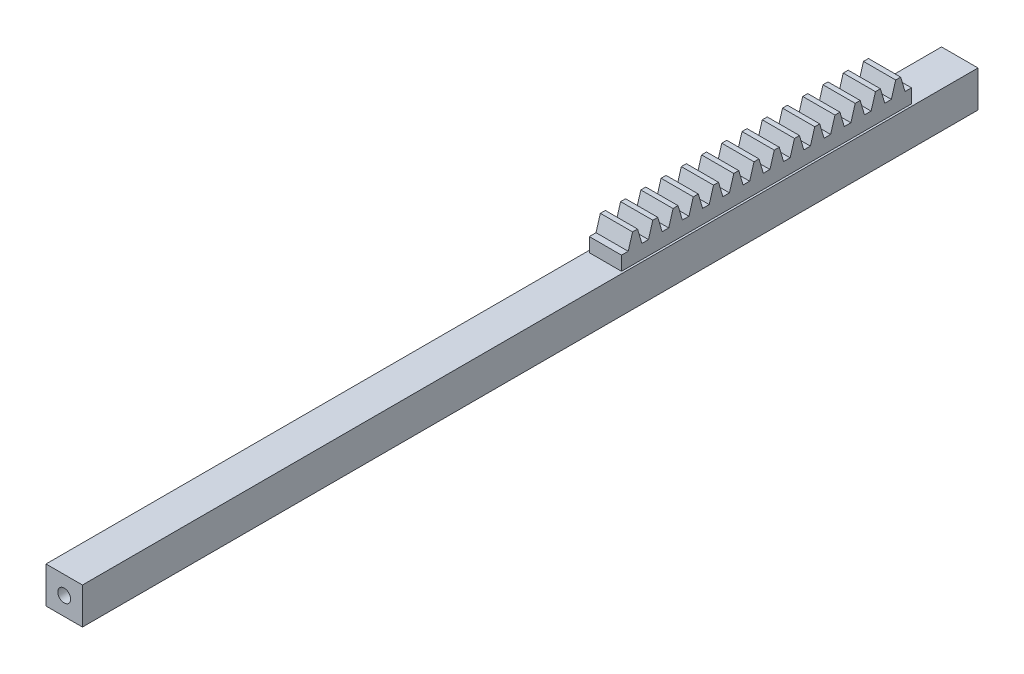
from build123d import *

# Parameters (mm, degrees)
ESQUISSE1_W                    = 5
ESQUISSE1_H                    = 45
BOSS_EXTRU_1_DEPTH             = 5
CARR_DEPTH                     = 10
CARR_DEPTH_BACK                = 129
ESQUISSE7_W                    = 5.65685425
ESQUISSE7_H                    = 5.65685425
BOSS_EXTRU_3_REACH             = 108.655
BOSS_EXTRU_3_DIRECTION_2_REACH = 108.655
R_P_TITION_LIN_AIRE1_COUNT     = 14
R_P_TITION_LIN_AIRE1_PITCH     = 3.141592
ESQUISSE8_R                    = 1
ENL_V_MAT_EXTRU_3_DEPTH        = 10
ENL_V_START                    = -10
ESQUISSE9_R                    = 1
ENL_V_MAT_EXTRU_4_DEPTH        = 10


with BuildPart() as part:
    # Esquisse1 → Boss.-Extru.1 (new body)
    with BuildSketch(Plane(origin=(0, 0, 0), x_dir=(1, 0, 0), z_dir=(0, 1, 0))):
        Rectangle(ESQUISSE1_W, ESQUISSE1_H)
    extrude(amount=BOSS_EXTRU_1_DEPTH)

    # Esquisse7 → Carré (add, two sides: drawn at the far end of the back side and taken through both)
    with BuildSketch(Plane(origin=(0, 0, -22.5), x_dir=(-1, 0, 0), z_dir=(0, 0, -1)).offset(-CARR_DEPTH_BACK)):
        Rectangle(ESQUISSE7_W, ESQUISSE7_H)
    extrude(amount=CARR_DEPTH + CARR_DEPTH_BACK)

    # Boss.-Extru.3: up to this face of the body (flat: up to its plane)
    boss_extru_3_end = Plane(part.part.faces().sort_by_distance((2.5, 3.914213562, 0))[0])
    # Esquisse3 → Boss.-Extru.3 (add, up to the picked face)
    with BuildSketch(Plane(origin=(0, 0, 0), x_dir=(0, 0, -1), z_dir=(1, 0, 0)), mode=Mode.PRIVATE) as boss_extru_3_sk1:
        with BuildLine():
            Line((19.381081141, 5), (21.5, 5))
            Line((21.5, 5), (20.828241228, 7.270751612))
            ThreePointArc((20.828241228, 7.270751612), (20.440540571, 7.273642384), (20.052839914, 7.270751612))
            Line((20.052839914, 7.270751612), (19.381081141, 5))
        make_face()
    boss_extru_3_tool1 = split(extrude(boss_extru_3_sk1.sketch, amount=BOSS_EXTRU_3_REACH, mode=Mode.PRIVATE), bisect_by=boss_extru_3_end, keep=Keep.BOTH, mode=Mode.PRIVATE)
    boss_extru_3 = boss_extru_3_tool1.solids().sort_by(Axis((0, 5.960295, -20.440541), (1, 0, 0)))[0]
    add(boss_extru_3)

    # Boss.-Extru.3 direction 2: up to this face of the body (flat: up to its plane)
    boss_extru_3_direction_2_end = Plane(part.part.faces().sort_by_distance((-2.5, 3.914213562, 0))[0])
    # Esquisse3 → Boss.-Extru.3 direction 2 (add, up to the picked face)
    with BuildSketch(Plane(origin=(0, 0, 0), x_dir=(0, 0, -1), z_dir=(1, 0, 0)), mode=Mode.PRIVATE) as boss_extru_3_direction_2_sk1:
        with BuildLine():
            Line((19.381081141, 5), (21.5, 5))
            Line((21.5, 5), (20.828241228, 7.270751612))
            ThreePointArc((20.828241228, 7.270751612), (20.440540571, 7.273642384), (20.052839914, 7.270751612))
            Line((20.052839914, 7.270751612), (19.381081141, 5))
        make_face()
    boss_extru_3_direction_2_tool1 = split(extrude(boss_extru_3_direction_2_sk1.sketch, amount=-BOSS_EXTRU_3_DIRECTION_2_REACH, mode=Mode.PRIVATE), bisect_by=boss_extru_3_direction_2_end, keep=Keep.BOTH, mode=Mode.PRIVATE)
    boss_extru_3_direction_2 = boss_extru_3_direction_2_tool1.solids().sort_by(Axis((0, 5.960295, -20.440541), (-1, 0, 0)))[0]
    add(boss_extru_3_direction_2)

    # Répétition linéaire1: Boss.-Extru.3, Boss.-Extru.3 direction 2 ×14
    with Locations(*[(0, 0, i * R_P_TITION_LIN_AIRE1_PITCH) for i in range(1, R_P_TITION_LIN_AIRE1_COUNT)]):
        add(boss_extru_3)
        add(boss_extru_3_direction_2)

    # Esquisse8 → Enlèv. mat.-Extru.3 (cut)
    with BuildSketch(Plane(origin=(0, 0, -32.5), x_dir=(-1, 0, 0), z_dir=(0, 0, -1))):
        Circle(ESQUISSE8_R)
    extrude(amount=-ENL_V_MAT_EXTRU_3_DEPTH, mode=Mode.SUBTRACT)

    # Esquisse9 → Enlèv. mat.-Extru.4 (cut)
    with BuildSketch(Plane.XY.offset(106.5).offset(ENL_V_START)):
        Circle(ESQUISSE9_R)
    extrude(amount=ENL_V_MAT_EXTRU_4_DEPTH, mode=Mode.SUBTRACT)


solid = part.part
